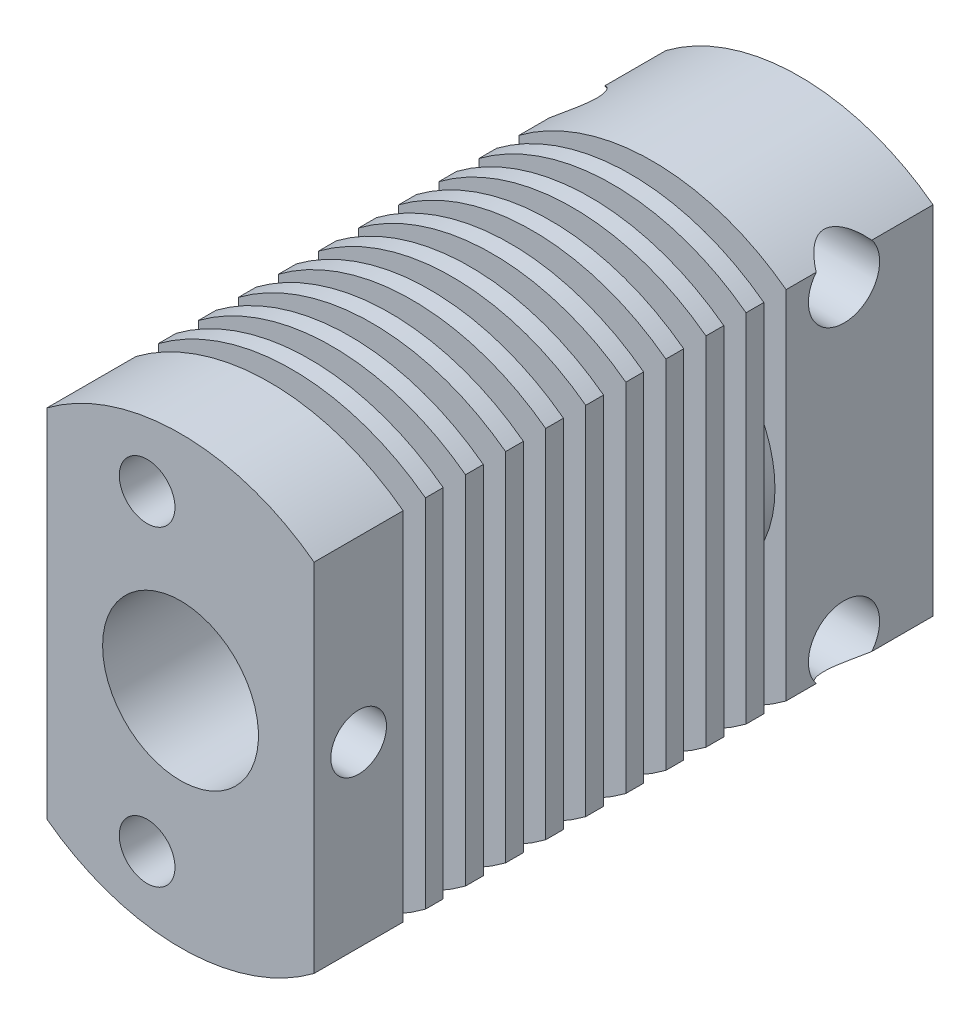
from build123d import *

# Parameters (mm, degrees)
CROQUIS1_W                           = 4.3
CROQUIS1_H                           = 1
SALIENTE_EXTRUIR1_DEPTH              = 0.8
SALIENTE_EXTRUIR2_START              = -0.8
SALIENTE_EXTRUIR2_DEPTH              = 0.8
CROQUIS4_R                           = 4.3
SALIENTE_EXTRUIR3_DEPTH              = 1
SALIENTE_EXTRUIR4_START              = 1
CROQUIS5_R                           = 4.3
SALIENTE_EXTRUIR4_DEPTH              = 1
SALIENTE_EXTRUIR5_DEPTH              = 0.8
SALIENTE_EXTRUIR6_START              = -0.8
SALIENTE_EXTRUIR6_DEPTH              = 0.8
CROQUIS8_R                           = 4.3
SALIENTE_EXTRUIR7_DEPTH              = 1
SALIENTE_EXTRUIR8_START              = 1
CROQUIS9_R                           = 4.3
SALIENTE_EXTRUIR8_DEPTH              = 1
SALIENTE_EXTRUIR9_DEPTH              = 0.8
SALIENTE_EXTRUIR10_START             = -0.8
SALIENTE_EXTRUIR10_DEPTH             = 0.8
CROQUIS12_R                          = 4.3
SALIENTE_EXTRUIR11_DEPTH             = 1
SALIENTE_EXTRUIR12_START             = 1
CROQUIS13_R                          = 4.3
SALIENTE_EXTRUIR12_DEPTH             = 1
SALIENTE_EXTRUIR13_DEPTH             = 0.8
SALIENTE_EXTRUIR14_START             = -0.8
SALIENTE_EXTRUIR14_DEPTH             = 0.8
CROQUIS16_R                          = 4.3
SALIENTE_EXTRUIR15_DEPTH             = 1
CROQUIS17_R                          = 5.5
SALIENTE_EXTRUIR16_DEPTH             = 1
SALIENTE_EXTRUIR17_DEPTH             = 6.6
SALIENTE_EXTRUIR18_START             = -0.8
SALIENTE_EXTRUIR18_DEPTH             = 0.8
CROQUIS20_R                          = 4.3
SALIENTE_EXTRUIR19_DEPTH             = 1
SALIENTE_EXTRUIR20_START             = -4
SALIENTE_EXTRUIR20_DEPTH             = 4
CROQUIS22_R                          = 4.9
CORTAR_EXTRUIR1_DEPTH                = 8
CROQUIS23_R                          = 3.5
CORTAR_EXTRUIR2_DEPTH                = 16.7
CROQUIS24_R                          = 4.1
CORTAR_EXTRUIR3_DEPTH                = 1.6
CORTAR_EXTRUIR3_DRAFT                = -45
CROQUIS25_R                          = 2.5
CORTAR_EXTRUIR4_DEPTH                = 1.5
DI_METRO_DE_TALADRO_2_5_2_5_1_D      = 2.5
DI_METRO_DE_TALADRO_2_5_2_5_1_DEPTH  = 4
DI_METRO_DE_TALADRO_2_5_2_5_2_REACH  = 30.468
DI_METRO_DE_TALADRO_2_5_2_5_2_BORE_R = 1.25
DI_METRO_DE_TALADRO_3_2_3_2_1_D      = 3.2
DI_METRO_DE_TALADRO_3_2_3_2_2_D      = 3.2
REDONDEO1_R                          = 1


with BuildPart() as part:
    # Croquis1 → Revolución1 (revolve)
    with BuildSketch(Plane(origin=(0, 0, 0), x_dir=(1, 0, 0), z_dir=(0, 1, 0))):
        with Locations((2.15, -10.3)):
            Rectangle(CROQUIS1_W, CROQUIS1_H)
    revolve(axis=Axis((0, 0, 9.8), (0, 0, 1)))

    # Croquis2 → Saliente-Extruir1 (add)
    with BuildSketch(Plane.XY.offset(9.8)):
        with BuildLine():
            Line((-6, 8), (-6, -8))
            ThreePointArc((-6, -8), (0, -10), (6, -8))
            Line((6, -8), (6, 8))
            ThreePointArc((6, 8), (0, 10), (-6, 8))
        make_face()
    extrude(amount=-SALIENTE_EXTRUIR1_DEPTH)

    # Croquis3 → Saliente-Extruir2 (add)
    with BuildSketch(Plane(origin=(0, 0, 10.8), x_dir=(-1, 0, 0), z_dir=(0, 0, -1)).offset(SALIENTE_EXTRUIR2_START)):
        with BuildLine():
            Line((6, -8), (6, 8))
            ThreePointArc((6, 8), (0, 10), (-6, 8))
            Line((-6, 8), (-6, -8))
            ThreePointArc((-6, -8), (0, -10), (6, -8))
        make_face()
    extrude(amount=SALIENTE_EXTRUIR2_DEPTH)

    # Croquis4 → Saliente-Extruir3 (add)
    with BuildSketch(Plane.XY.offset(11.6)):
        Circle(CROQUIS4_R)
    extrude(amount=SALIENTE_EXTRUIR3_DEPTH)

    # Croquis5 → Saliente-Extruir4 (add)
    with BuildSketch(Plane(origin=(0, 0, 9), x_dir=(-1, 0, 0), z_dir=(0, 0, -1)).offset(SALIENTE_EXTRUIR4_START)):
        with Locations(Location((0, 0, 0), (0, 0, 180))):
            Circle(CROQUIS5_R)
    extrude(amount=-SALIENTE_EXTRUIR4_DEPTH)

    # Croquis6 → Saliente-Extruir5 (add)
    with BuildSketch(Plane.XY.offset(8)):
        with BuildLine():
            Line((-6, 8), (-6, -8))
            ThreePointArc((-6, -8), (0, -10), (6, -8))
            Line((6, -8), (6, 8))
            ThreePointArc((6, 8), (0, 10), (-6, 8))
        make_face()
    extrude(amount=-SALIENTE_EXTRUIR5_DEPTH)

    # Croquis7 → Saliente-Extruir6 (add)
    with BuildSketch(Plane(origin=(0, 0, 12.6), x_dir=(-1, 0, 0), z_dir=(0, 0, -1)).offset(SALIENTE_EXTRUIR6_START)):
        with BuildLine():
            Line((6, -8), (6, 8))
            ThreePointArc((6, 8), (0, 10), (-6, 8))
            Line((-6, 8), (-6, -8))
            ThreePointArc((-6, -8), (0, -10), (6, -8))
        make_face()
    extrude(amount=SALIENTE_EXTRUIR6_DEPTH)

    # Croquis8 → Saliente-Extruir7 (add)
    with BuildSketch(Plane.XY.offset(13.4)):
        Circle(CROQUIS8_R)
    extrude(amount=SALIENTE_EXTRUIR7_DEPTH)

    # Croquis9 → Saliente-Extruir8 (add)
    with BuildSketch(Plane(origin=(0, 0, 7.2), x_dir=(-1, 0, 0), z_dir=(0, 0, -1)).offset(SALIENTE_EXTRUIR8_START)):
        with Locations(Location((0, 0, 0), (0, 0, 180))):
            Circle(CROQUIS9_R)
    extrude(amount=-SALIENTE_EXTRUIR8_DEPTH)

    # Croquis10 → Saliente-Extruir9 (add)
    with BuildSketch(Plane.XY.offset(6.2)):
        with BuildLine():
            Line((-6, 8), (-6, -8))
            ThreePointArc((-6, -8), (0, -10), (6, -8))
            Line((6, -8), (6, 8))
            ThreePointArc((6, 8), (0, 10), (-6, 8))
        make_face()
    extrude(amount=-SALIENTE_EXTRUIR9_DEPTH)

    # Croquis11 → Saliente-Extruir10 (add)
    with BuildSketch(Plane(origin=(0, 0, 14.4), x_dir=(-1, 0, 0), z_dir=(0, 0, -1)).offset(SALIENTE_EXTRUIR10_START)):
        with BuildLine():
            Line((6, -8), (6, 8))
            ThreePointArc((6, 8), (0, 10), (-6, 8))
            Line((-6, 8), (-6, -8))
            ThreePointArc((-6, -8), (0, -10), (6, -8))
        make_face()
    extrude(amount=SALIENTE_EXTRUIR10_DEPTH)

    # Croquis12 → Saliente-Extruir11 (add)
    with BuildSketch(Plane.XY.offset(15.2)):
        Circle(CROQUIS12_R)
    extrude(amount=SALIENTE_EXTRUIR11_DEPTH)

    # Croquis13 → Saliente-Extruir12 (add)
    with BuildSketch(Plane(origin=(0, 0, 5.4), x_dir=(-1, 0, 0), z_dir=(0, 0, -1)).offset(SALIENTE_EXTRUIR12_START)):
        with Locations(Location((0, 0, 0), (0, 0, 180))):
            Circle(CROQUIS13_R)
    extrude(amount=-SALIENTE_EXTRUIR12_DEPTH)

    # Croquis14 → Saliente-Extruir13 (add)
    with BuildSketch(Plane.XY.offset(4.4)):
        with BuildLine():
            Line((6, -8), (6, 8))
            ThreePointArc((6, 8), (0, 10), (-6, 8))
            Line((-6, 8), (-6, -8))
            ThreePointArc((-6, -8), (0, -10), (6, -8))
        make_face()
    extrude(amount=-SALIENTE_EXTRUIR13_DEPTH)

    # Croquis15 → Saliente-Extruir14 (add)
    with BuildSketch(Plane(origin=(0, 0, 16.2), x_dir=(-1, 0, 0), z_dir=(0, 0, -1)).offset(SALIENTE_EXTRUIR14_START)):
        with BuildLine():
            Line((6, -8), (6, 8))
            ThreePointArc((6, 8), (0, 10), (-6, 8))
            Line((-6, 8), (-6, -8))
            ThreePointArc((-6, -8), (0, -10), (6, -8))
        make_face()
    extrude(amount=SALIENTE_EXTRUIR14_DEPTH)

    # Croquis16 → Saliente-Extruir15 (add)
    with BuildSketch(Plane.XY.offset(17)):
        Circle(CROQUIS16_R)
    extrude(amount=SALIENTE_EXTRUIR15_DEPTH)

    # Croquis17 → Saliente-Extruir16 (add)
    with BuildSketch(Plane(origin=(0, 0, 3.6), x_dir=(-1, 0, 0), z_dir=(0, 0, -1))):
        Circle(CROQUIS17_R)
    extrude(amount=SALIENTE_EXTRUIR16_DEPTH)

    # Croquis18 → Saliente-Extruir17 (add)
    with BuildSketch(Plane.XY.offset(2.6)):
        with BuildLine():
            Line((-6, 8), (-6, -8))
            ThreePointArc((-6, -8), (0, -10), (6, -8))
            Line((6, -8), (6, 8))
            ThreePointArc((6, 8), (0, 10), (-6, 8))
        make_face()
    extrude(amount=-SALIENTE_EXTRUIR17_DEPTH)

    # Croquis19 → Saliente-Extruir18 (add)
    with BuildSketch(Plane(origin=(0, 0, 18), x_dir=(-1, 0, 0), z_dir=(0, 0, -1)).offset(SALIENTE_EXTRUIR18_START)):
        with BuildLine():
            Line((-6, 8), (-6, -8))
            ThreePointArc((-6, -8), (0, -10), (6, -8))
            Line((6, -8), (6, 8))
            ThreePointArc((6, 8), (0, 10), (-6, 8))
        make_face()
    extrude(amount=SALIENTE_EXTRUIR18_DEPTH)

    # Croquis20 → Saliente-Extruir19 (add)
    with BuildSketch(Plane.XY.offset(18.8)):
        Circle(CROQUIS20_R)
    extrude(amount=SALIENTE_EXTRUIR19_DEPTH)

    # Croquis21 → Saliente-Extruir20 (add)
    with BuildSketch(Plane(origin=(0, 0, 19.8), x_dir=(-1, 0, 0), z_dir=(0, 0, -1)).offset(SALIENTE_EXTRUIR20_START)):
        with BuildLine():
            Line((6, -8), (6, 8))
            ThreePointArc((6, 8), (0, 10), (-6, 8))
            Line((-6, 8), (-6, -8))
            ThreePointArc((-6, -8), (0, -10), (6, -8))
        make_face()
    extrude(amount=SALIENTE_EXTRUIR20_DEPTH)

    # Croquis22 → Cortar-Extruir1 (cut)
    with BuildSketch(Plane(origin=(0, 0, -4), x_dir=(-1, 0, 0), z_dir=(0, 0, -1))):
        with Locations(Location((0, 0, 0), (0, 0, 180))):
            Circle(CROQUIS22_R)
    extrude(amount=-CORTAR_EXTRUIR1_DEPTH, mode=Mode.SUBTRACT)

    # Croquis23 → Cortar-Extruir2 (cut)
    with BuildSketch(Plane.XY.offset(23.8)):
        with Locations(Location((0, 0, 0), (0, 0, 180))):
            Circle(CROQUIS23_R)
    extrude(amount=-CORTAR_EXTRUIR2_DEPTH, mode=Mode.SUBTRACT)


with BuildPart() as cortar_extruir3_tool:
    # Croquis24 → Cortar-Extruir3 (with draft: the straight prism first)
    with BuildSketch(Plane(origin=(0, 0, 4), x_dir=(-1, 0, 0), z_dir=(0, 0, -1))):
        Circle(CROQUIS24_R)
    extrude(amount=-CORTAR_EXTRUIR3_DEPTH)
    # Cortar-Extruir3: the draft: its side faces are tilted about the plane it starts from
    cortar_extruir3_sides = [cortar_extruir3_tool.faces().sort_by_distance(p)[0] for p in [
        (4.1, 0, 4.8),
    ]]
    draft(cortar_extruir3_sides, Plane(origin=(0, 0, 4), x_dir=(-1, 0, 0), z_dir=(0, 0, -1)), CORTAR_EXTRUIR3_DRAFT)


with BuildPart() as part_1:
    add(part.part)

    # Cortar-Extruir3: cut by cortar_extruir3_tool
    add(cortar_extruir3_tool.part, mode=Mode.SUBTRACT)

    # Croquis25 → Cortar-Extruir4 (cut)
    with BuildSketch(Plane.XY.offset(7.1)):
        with Locations(Location((0, 0, 0), (0, 0, 180))):
            Circle(CROQUIS25_R)
    extrude(amount=-CORTAR_EXTRUIR4_DEPTH, mode=Mode.SUBTRACT)

    # Diámetro de taladro Ø2.5 (2.5)1
    with Locations(Plane.XY.offset(23.8)):
        with Locations((-1.5, -7), (-1.5, 7)):
            Hole(DI_METRO_DE_TALADRO_2_5_2_5_1_D / 2, depth=DI_METRO_DE_TALADRO_2_5_2_5_1_DEPTH)

    # Diámetro de taladro Ø2.5 (2.5)2 bore → Diámetro de taladro Ø2.5 (2.5)2 (cut, up to next)
    with BuildSketch(Plane(origin=(6, 0, 0), x_dir=(0, 0, -1), z_dir=(1, 0, 0)), mode=Mode.PRIVATE) as di_metro_de_taladro_2_5_2_5_2_sk1:
        with Locations((-21.8, 0)):
            Circle(DI_METRO_DE_TALADRO_2_5_2_5_2_BORE_R)
    di_metro_de_taladro_2_5_2_5_2_tool1 = extrude(di_metro_de_taladro_2_5_2_5_2_sk1.sketch, amount=-DI_METRO_DE_TALADRO_2_5_2_5_2_REACH, mode=Mode.PRIVATE) & part_1.part
    add(di_metro_de_taladro_2_5_2_5_2_tool1.solids().sort_by_distance((6, 0, 21.8))[0], mode=Mode.SUBTRACT)

    # Diámetro de taladro Ø3.2 (3.2)1 (through all)
    with Locations(Plane.ZY.offset(6)):
        with Locations((0, 7)):
            Hole(DI_METRO_DE_TALADRO_3_2_3_2_1_D / 2)

    # Diámetro de taladro Ø3.2 (3.2)2 (through all)
    with Locations(Plane(origin=(6, 0, 0), x_dir=(0, 0, -1), z_dir=(1, 0, 0))):
        with Locations((0, -7)):
            Hole(DI_METRO_DE_TALADRO_3_2_3_2_2_D / 2)

    # Redondeo1
    redondeo1_edges = [part_1.edges().sort_by_distance(p)[0] for p in [
        (4.1, 0, 4),
        (2.5, 0, 5.6),
    ]]
    fillet(redondeo1_edges, radius=REDONDEO1_R)


solid = part_1.part
